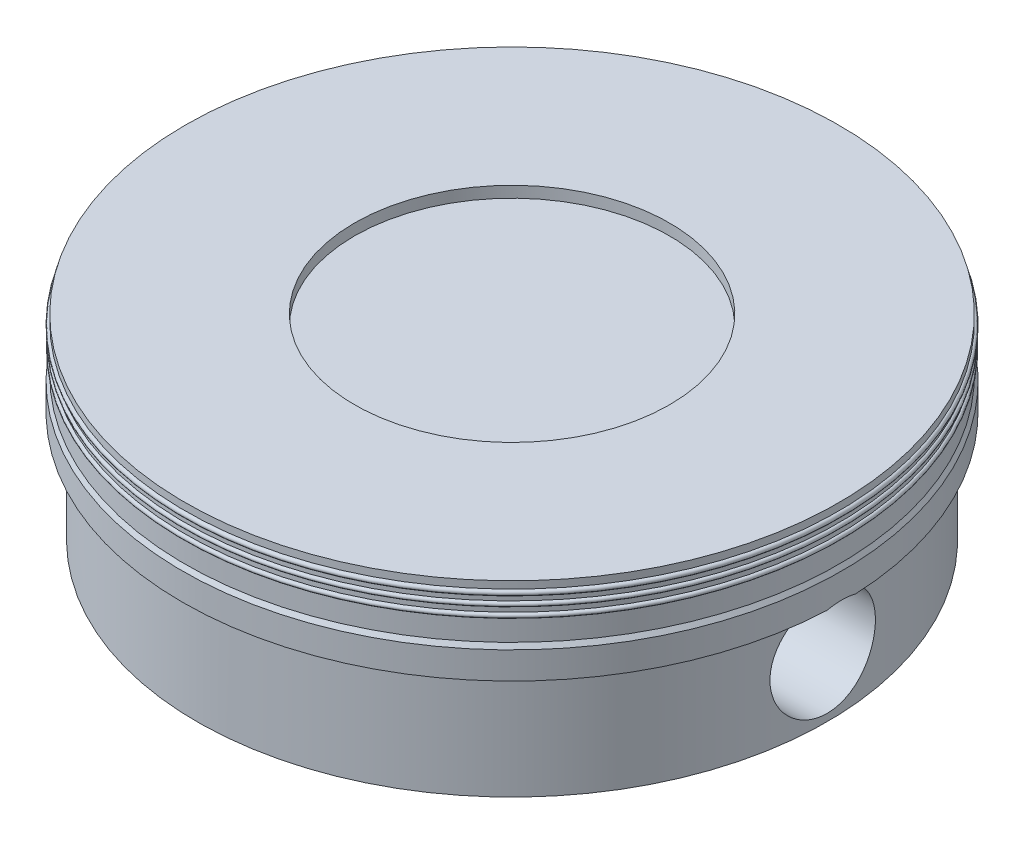
from build123d import *

# Parameters (mm, degrees)
BOSS_EXTRUDE1_REACH     = 9.67
CUT_EXTRUDE1_DEPTH      = 8.669887472
CUT_EXTRUDE1_DEPTH_BACK = 8.669887472
SKETCH3_R               = 0.8


with BuildPart() as part:
    # Sketch1 → Revolve1 (revolve)
    with BuildSketch(Plane.XY, mode=Mode.PRIVATE) as revolve1_sk:
        with BuildLine():
            Line((3.43, 0), (3.43, 1.93))
            Line((3.43, 1.93), (4.2, 1.93))
            Line((4.2, 1.93), (4.2, 2.33))
            Line((4.2, 2.33), (0, 2.33))
            Line((0, 2.33), (0, 2.8))
            Line((0, 2.8), (2.39, 2.8))
            Line((2.39, 2.8), (2.39, 2.97))
            Line((2.39, 2.97), (4.96, 2.97))
            Line((4.96, 2.97), (4.96, 2.860313582))
            ThreePointArc((4.96, 2.860313582), (5.000313582, 2.82), (4.96, 2.779686418))
            Line((4.96, 2.779686418), (4.96, 2.705152359))
            ThreePointArc((4.96, 2.705152359), (4.995152359, 2.67), (4.96, 2.634847641))
            Line((4.96, 2.634847641), (4.96, 2.556379712))
            ThreePointArc((4.96, 2.556379712), (4.996379712, 2.52), (4.96, 2.483620288))
            Line((4.96, 2.483620288), (4.96, 2.16))
            Line((4.96, 2.16), (5, 2.09))
            Line((5, 2.09), (5, 1.68))
            Line((5, 1.68), (4.78, 1.68))
            Line((4.78, 1.68), (4.78, 0))
            Line((4.78, 0), (3.43, 0))
        make_face()
    revolve(revolve1_sk.sketch.rotate(Axis((0, 3, 0), (0, -1, 0)), 180), axis=Axis((0, 3, 0), (0, -1, 0)))

    # Boss-Extrude1: up to this face of the body (flat: up to its plane)
    boss_extrude1_end = Plane(part.part.faces().sort_by_distance((0, 2.33, 0))[0])
    # Sketch2 → Boss-Extrude1 (add, up to the picked face)
    with BuildSketch(Plane.XZ, mode=Mode.PRIVATE) as boss_extrude1_sk1:
        with BuildLine():
            Line((-1.75, 2.949983051), (-1.75, -2.949983051))
            ThreePointArc((-1.75, -2.949983051), (-3.43, 0), (-1.75, 2.949983051))
        make_face()
    boss_extrude1_tool1 = split(extrude(boss_extrude1_sk1.sketch, amount=-BOSS_EXTRUDE1_REACH, mode=Mode.PRIVATE), bisect_by=boss_extrude1_end, keep=Keep.BOTH, mode=Mode.PRIVATE)
    # Sketch2 → Boss-Extrude1 (add, up to the picked face)
    with BuildSketch(Plane.XZ, mode=Mode.PRIVATE) as boss_extrude1_sk2:
        with BuildLine():
            Line((1.75, 2.949983051), (1.75, -2.949983051))
            ThreePointArc((1.75, -2.949983051), (3.43, 0), (1.75, 2.949983051))
        make_face()
    boss_extrude1_tool2 = split(extrude(boss_extrude1_sk2.sketch, amount=-BOSS_EXTRUDE1_REACH, mode=Mode.PRIVATE), bisect_by=boss_extrude1_end, keep=Keep.BOTH, mode=Mode.PRIVATE)
    add(boss_extrude1_tool1.solids().sort_by(Axis((-2.438465, 0, 0), (0, 1, 0)))[0])
    add(boss_extrude1_tool2.solids().sort_by(Axis((2.438465, 0, 0), (0, 1, 0)))[0])

    # Sketch3 → Cut-Extrude1 (cut, two sides: drawn at the far end of the back side and taken through both)
    with BuildSketch(Plane(origin=(0, 0, 0), x_dir=(0, 0, -1), z_dir=(1, 0, 0)).offset(-CUT_EXTRUDE1_DEPTH_BACK)):
        with Locations(Location((0, 0.91, 0), (0, 0, 74.259451475))):
            Circle(SKETCH3_R)
    extrude(amount=CUT_EXTRUDE1_DEPTH + CUT_EXTRUDE1_DEPTH_BACK, mode=Mode.SUBTRACT)


solid = part.part
